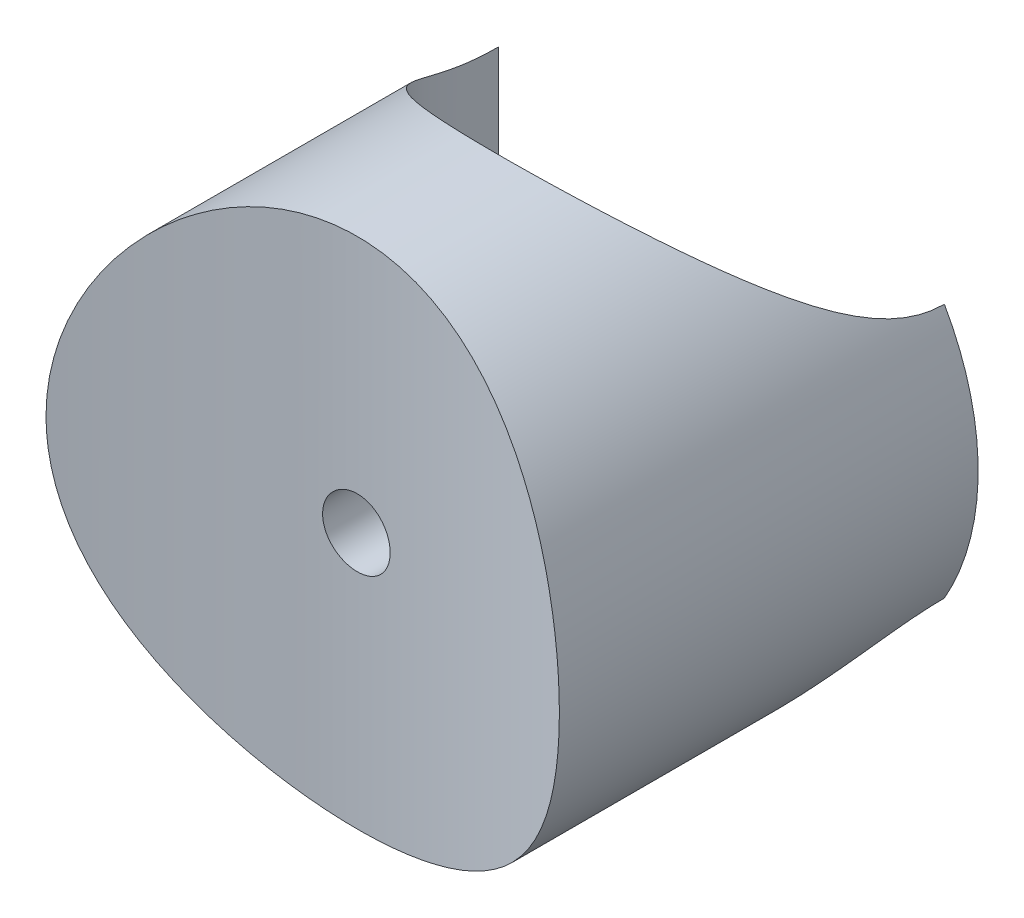
from build123d import *

# Parameters (mm, degrees)
ESBO_O1_R                  = 19
RESSALTO_EXTRUS_O1_DEPTH   = 7.5
CORTE_EXTRUS_O1_DEPTH      = 28.897132469
CORTE_EXTRUS_O1_DEPTH_BACK = 28.897132469
ESBO_O7_R                  = 19
RESSALTO_EXTRUS_O3_DEPTH   = 25
ESBO_O8_R                  = 16.5
CORTE_EXTRUS_O2_DEPTH      = 29
FURO_ROSCADO_DE_M62_D      = 5


with BuildPart() as part:
    # Esboço1 → Ressalto-extrusão1 (new, symmetric)
    with BuildSketch(Plane.XY):
        Circle(ESBO_O1_R)
    extrude(amount=RESSALTO_EXTRUS_O1_DEPTH, both=True)

    # Esboço2 → Corte-extrusão1 (cut, two sides: drawn at the far end of the back side and taken through both)
    with BuildSketch(Plane(origin=(0, 0, 0), x_dir=(1, 0, 0), z_dir=(0, 1, 0)).offset(-CORTE_EXTRUS_O1_DEPTH_BACK)):
        with BuildLine():
            Line((-99.472761542, -34.36341569), (-19, 1.5))
            ThreePointArc((-19, 1.5), (0, 5.542140614), (19, 1.5))
            Line((19, 1.5), (99.472761542, -34.36341569))
            Line((99.472761542, -34.36341569), (99.472761542, -210.568409208))
            Line((99.472761542, -210.568409208), (-99.472761542, -210.568409208))
            Line((-99.472761542, -210.568409208), (-99.472761542, -34.36341569))
        make_face()
    extrude(amount=CORTE_EXTRUS_O1_DEPTH + CORTE_EXTRUS_O1_DEPTH_BACK, mode=Mode.SUBTRACT)

    # Esboço7 → Ressalto-extrusão3 (add)
    with BuildSketch(Plane(origin=(0, 0, -7.5), x_dir=(-1, 0, 0), z_dir=(0, 0, -1))):
        Circle(ESBO_O7_R)
    extrude(amount=RESSALTO_EXTRUS_O3_DEPTH)

    # Esboço8 → Corte-extrusão2 (cut, symmetric)
    with BuildSketch(Plane(origin=(0, 0, 0), x_dir=(1, 0, 0), z_dir=(0, 1, 0))):
        with Locations((0, 32.5)):
            Circle(ESBO_O8_R)
    extrude(amount=CORTE_EXTRUS_O2_DEPTH, both=True, mode=Mode.SUBTRACT)

    # Furo roscado de M62 (through all)
    with Locations(Plane.XY):
        with Locations((0, 0)):
            Hole(FURO_ROSCADO_DE_M62_D / 2)


solid = part.part
